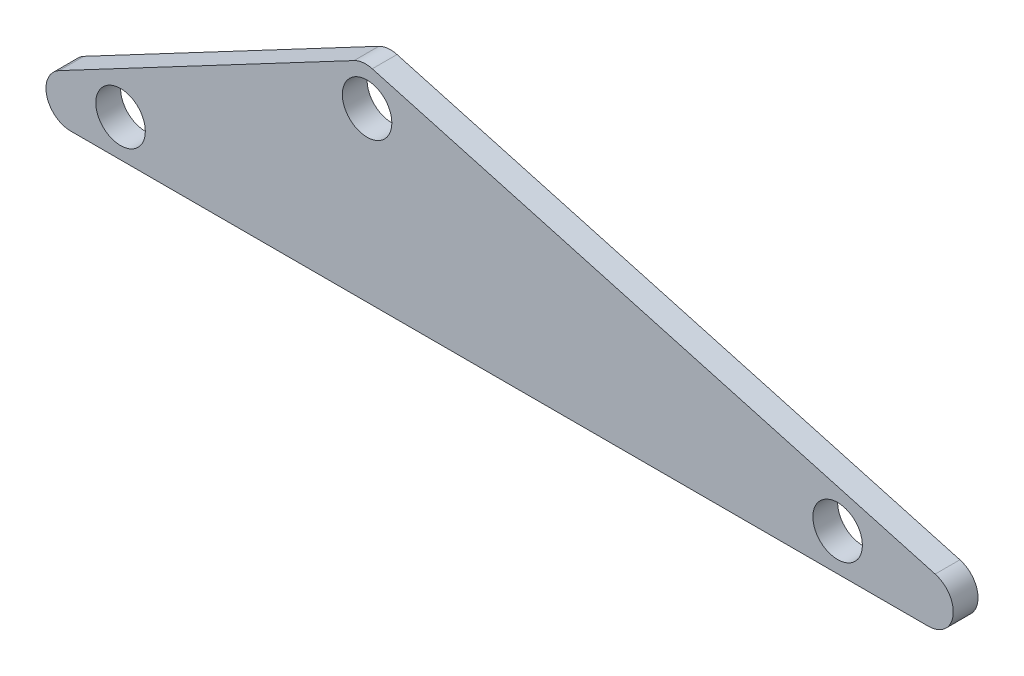
from build123d import *

# Parameters (mm, degrees)
SKETCH1_R           = 1
BOSS_EXTRUDE1_DEPTH = 0.5


with BuildPart() as part:
    # Sketch1 → Boss-Extrude1 (new, symmetric)
    with BuildSketch(Plane.XY):
        with BuildLine():
            Line((6.085309509, 5.469141511), (-5.830437798, -0.839652689))
            ThreePointArc((-5.830437798, -0.839652689), (-6.333032181, -1.964493074), (-5.362523581, -2.723426577))
            Line((-5.362523581, -2.723426577), (29.297564453, -2.723426577))
            ThreePointArc((29.297564453, -2.723426577), (30.288426963, -1.858302391), (29.56485123, -0.759809547))
            Line((29.56485123, -0.759809547), (6.820510503, 5.548984653))
            ThreePointArc((6.820510503, 5.548984653), (6.44525811, 5.579522252), (6.085309509, 5.469141511))
        make_face()
        with Locations((6.611324324, 4.050373423)):
            Circle(SKETCH1_R, mode=Mode.SUBTRACT)
        with Locations((-3.349575676, -1.223426577)):
            Circle(SKETCH1_R, mode=Mode.SUBTRACT)
        with Locations((25.624324324, -1.223426577)):
            Circle(SKETCH1_R, mode=Mode.SUBTRACT)
    extrude(amount=BOSS_EXTRUDE1_DEPTH, both=True)


solid = part.part
